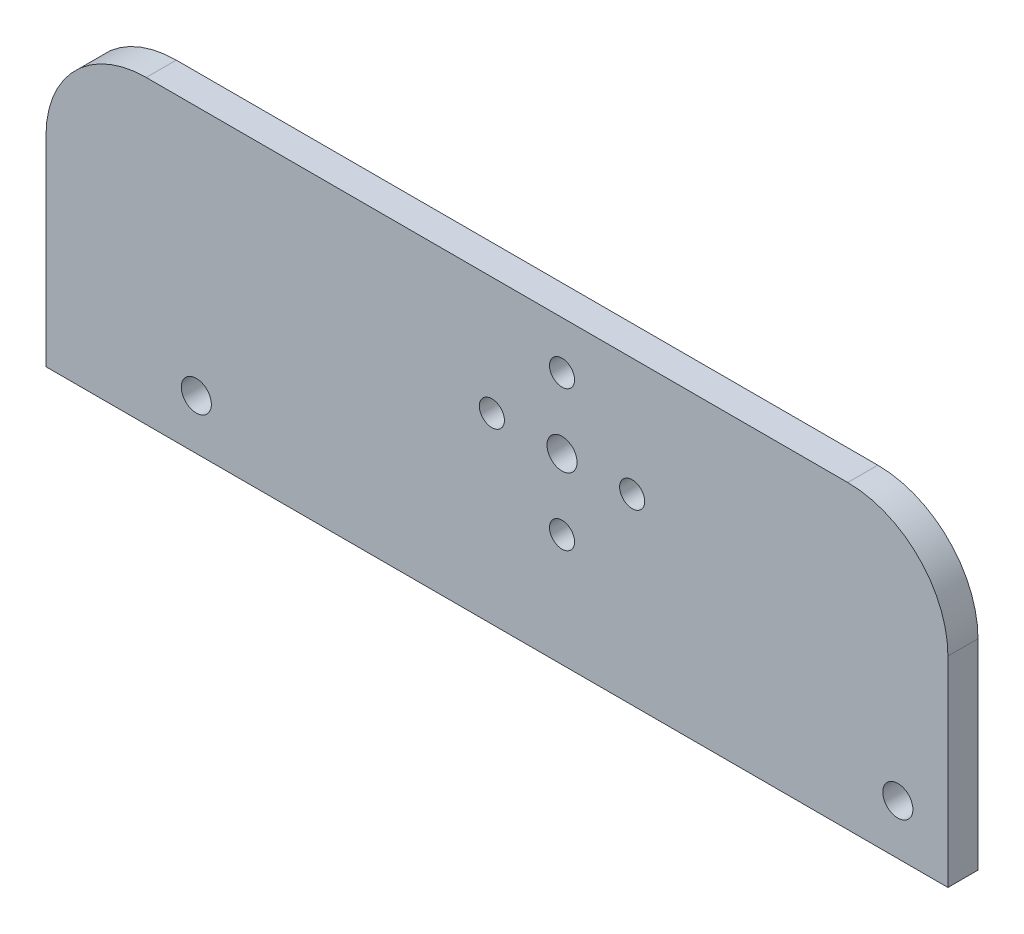
from build123d import *

# Parameters (mm, degrees)
SKETCH_1_W          = 90
SKETCH_1_H          = 30
EXTRUDE_1_DEPTH     = 3
SKETCH_3_R          = 1.5
SKETCH_3_R_2        = 1.25
CUT_EXTRUDE_2_DEPTH = 10
SKETCH_4_R          = 1.5
CUT_EXTRUDE_3_DEPTH = 10
FILLET_1_R          = 10


with BuildPart() as part:
    # 草图1 → 凸台-拉伸1 (new body)
    with BuildSketch(Plane.XY):
        Rectangle(SKETCH_1_W, SKETCH_1_H)
    extrude(amount=EXTRUDE_1_DEPTH)

    # 草图3 → 切除-拉伸2 (cut)
    with BuildSketch(Plane(origin=(0, 0, 0), x_dir=(-1, 0, 0), z_dir=(0, 0, -1))):
        with Locations((-6.49227102, 3.236967106)):
            Circle(SKETCH_3_R)
        with Locations((-13.49227102, 3.236967106)):
            Circle(SKETCH_3_R_2)
        with Locations((-6.49227102, 10.236967106)):
            Circle(SKETCH_3_R_2)
        with Locations((-6.49227102, -3.763032894)):
            Circle(SKETCH_3_R_2)
        with Locations((0.50772898, 3.236967106)):
            Circle(SKETCH_3_R_2)
    extrude(amount=-CUT_EXTRUDE_2_DEPTH, mode=Mode.SUBTRACT)

    # 草图4 → 切除-拉伸3 (cut)
    with BuildSketch(Plane(origin=(0, 0, 0), x_dir=(-1, 0, 0), z_dir=(0, 0, -1))):
        with Locations((-40, -10)):
            Circle(SKETCH_4_R)
        with Locations((30, -10)):
            Circle(SKETCH_4_R)
    extrude(amount=-CUT_EXTRUDE_3_DEPTH, mode=Mode.SUBTRACT)

    # 圆角1
    fillet_1_edges = [part.edges().sort_by_distance(p)[0] for p in [
        (-45, 15, 1.5),
        (45, 15, 1.5),
    ]]
    fillet(fillet_1_edges, radius=FILLET_1_R)


solid = part.part
